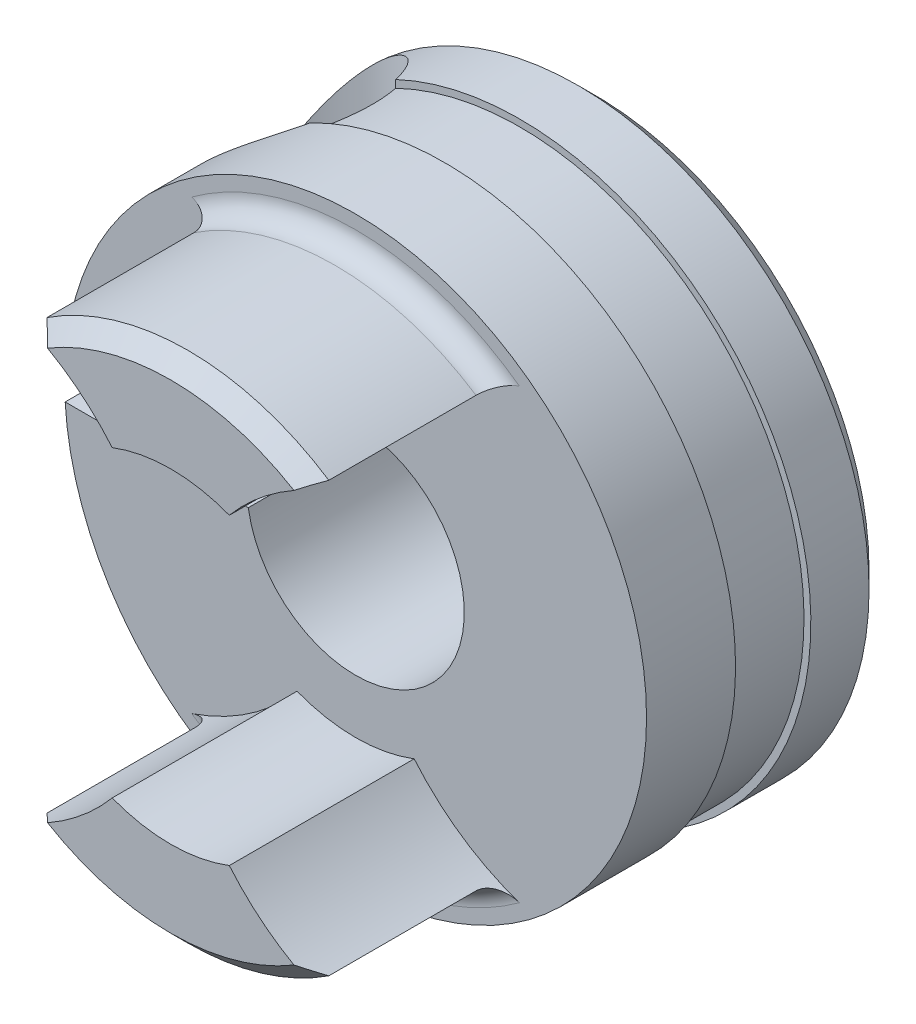
from build123d import *

# Parameters (mm, degrees)
SKETCH3_W          = 8.5
SKETCH3_H          = 1
CUT_EXTRUDE1_DEPTH = 12.4
CUT_EXTRUDE2_DEPTH = 12.4


with BuildPart() as part:
    # Sketch1 → Revolve1 (revolve)
    with BuildSketch(Plane(origin=(0, 0, 0), x_dir=(0, 0, -1), z_dir=(1, 0, 0))):
        with BuildLine():
            Line((-12.4, 7), (-12.4, 3.675))
            Line((-12.4, 3.675), (-11.9, 3.175))
            Line((-11.9, 3.175), (-0.5, 3.175))
            Line((-0.5, 3.175), (0, 3.675))
            Line((0, 3.675), (0, 8))
            Line((0, 8), (-0.5, 8.5))
            Line((-0.5, 8.5), (-2.2, 8.5))
            Line((-2.2, 8.5), (-2.2, 8.3))
            Line((-2.2, 8.3), (-4.4, 8.3))
            Line((-4.4, 8.3), (-4.4, 8.5))
            Line((-4.4, 8.5), (-7, 8.5))
            Line((-7, 8.5), (-7, 8.1))
            ThreePointArc((-7, 8.1), (-7.175735931, 7.675735931), (-7.6, 7.5))
            Line((-7.6, 7.5), (-11.9, 7.5))
            Line((-11.9, 7.5), (-12.4, 7))
        make_face()
    revolve(axis=Axis((0, 0, 0), (0, 0, 1)))

    # Sketch2 → Cut-Revolve1 (revolve, cut)
    with BuildSketch(Plane.XY.offset(3)):
        Polygon((-6, 8.5), (-3.5, 8.5), (-3.5, 2.3), (-4.9935, 2.3), (-4.9935, -8.5), (-6, -8.5), align=None)
    revolve(axis=Axis((-6, -8.5, 3), (0, 1, 0)), mode=Mode.SUBTRACT)

    # Sketch3 → Cut-Extrude1 (cut)
    with BuildSketch(Plane.XY):
        with Locations((-4.25, 0)):
            Rectangle(SKETCH3_W, SKETCH3_H)
    extrude(amount=CUT_EXTRUDE1_DEPTH, mode=Mode.SUBTRACT)

    # Sketch4 → Cut-Extrude2 (cut)
    with BuildSketch(Plane.XY.offset(7)):
        with BuildLine():
            ThreePointArc((-1.710892857, 4.431178808), (-13.9, 0), (-1.710892857, -4.431178808))
            ThreePointArc((-1.710892857, -4.431178808), (0, -4.75), (1.710892857, -4.431178808))
            ThreePointArc((1.710892857, -4.431178808), (13.9, 0), (1.710892857, 4.431178808))
            ThreePointArc((1.710892857, 4.431178808), (0, 4.75), (-1.710892857, 4.431178808))
        make_face()
    extrude(amount=CUT_EXTRUDE2_DEPTH, mode=Mode.SUBTRACT)


solid = part.part
